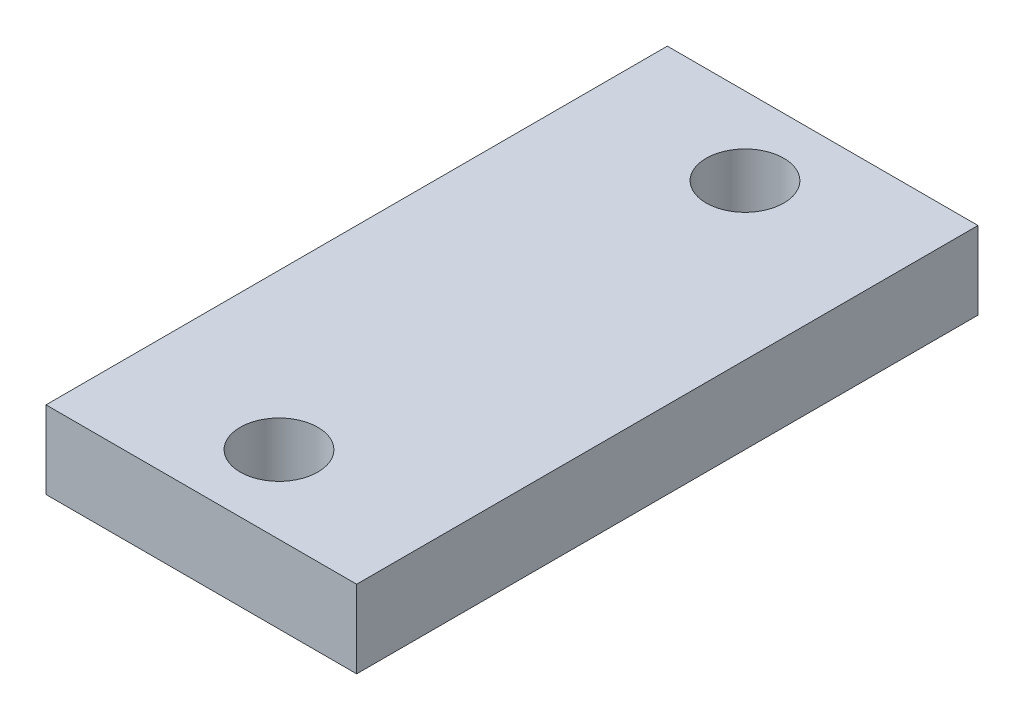
from build123d import *

# Parameters (mm, degrees)
SKETCH2_W           = 25.4
SKETCH2_H           = 50.8
SKETCH2_R           = 3.175
BOSS_EXTRUDE1_DEPTH = 6.35


with BuildPart() as part:
    # Sketch2 → Boss-Extrude1 (new body)
    with BuildSketch(Plane(origin=(0, 0, 0), x_dir=(1, 0, 0), z_dir=(0, 1, 0))):
        Rectangle(SKETCH2_W, SKETCH2_H)
        with Locations(Location((0, 19.05, 0), (0, 0, 270))):
            Circle(SKETCH2_R, mode=Mode.SUBTRACT)
        with Locations(Location((0, -19.05, 0), (0, 0, 270))):
            Circle(SKETCH2_R, mode=Mode.SUBTRACT)
    extrude(amount=BOSS_EXTRUDE1_DEPTH)


solid = part.part
